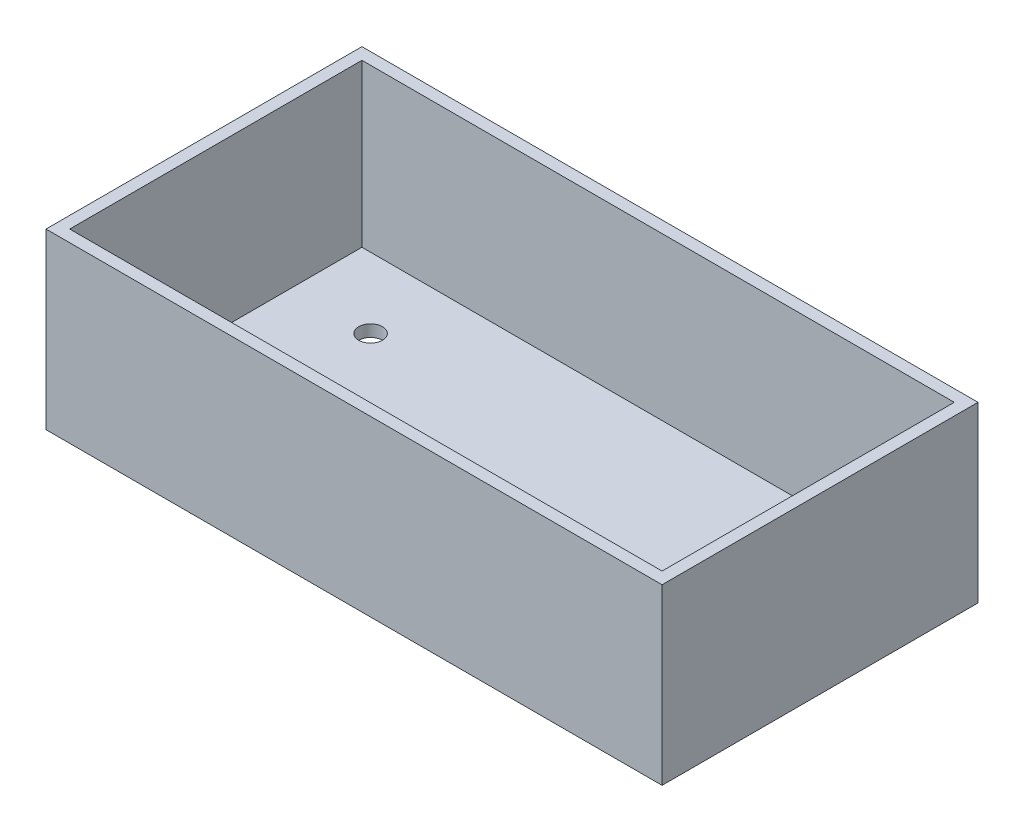
from build123d import *

# Parameters (mm, degrees)
SKETCH1_W           = 78
SKETCH1_H           = 40
BOSS_EXTRUDE1_DEPTH = 22
SHELL1_T            = -1.5
SKETCH2_R           = 1.5
CUT_EXTRUDE1_DEPTH  = 50.040799341


with BuildPart() as part:
    # Sketch1 → Boss-Extrude1 (new body)
    with BuildSketch(Plane(origin=(0, 0, 0), x_dir=(1, 0, 0), z_dir=(0, 1, 0))):
        Rectangle(SKETCH1_W, SKETCH1_H)
    extrude(amount=BOSS_EXTRUDE1_DEPTH)

    # Shell1
    shell1_openings = [part.faces().sort_by_distance(p)[0] for p in [
        (0, 22, 0),
    ]]
    offset(amount=SHELL1_T, openings=shell1_openings, kind=Kind.INTERSECTION)

    # Sketch2 → Cut-Extrude1 (cut, through all)
    with BuildSketch(Plane.XZ):
        with Locations(Location((27.5, 9.6, 0), (0, 0, 270))):
            Circle(SKETCH2_R)
        with Locations(Location((27.5, -9.6, 0), (0, 0, 270))):
            Circle(SKETCH2_R)
        with Locations(Location((-27.5, -9.6, 0), (0, 0, 270))):
            Circle(SKETCH2_R)
        with Locations(Location((-27.5, 9.6, 0), (0, 0, 270))):
            Circle(SKETCH2_R)
    extrude(amount=-CUT_EXTRUDE1_DEPTH, mode=Mode.SUBTRACT)


solid = part.part
